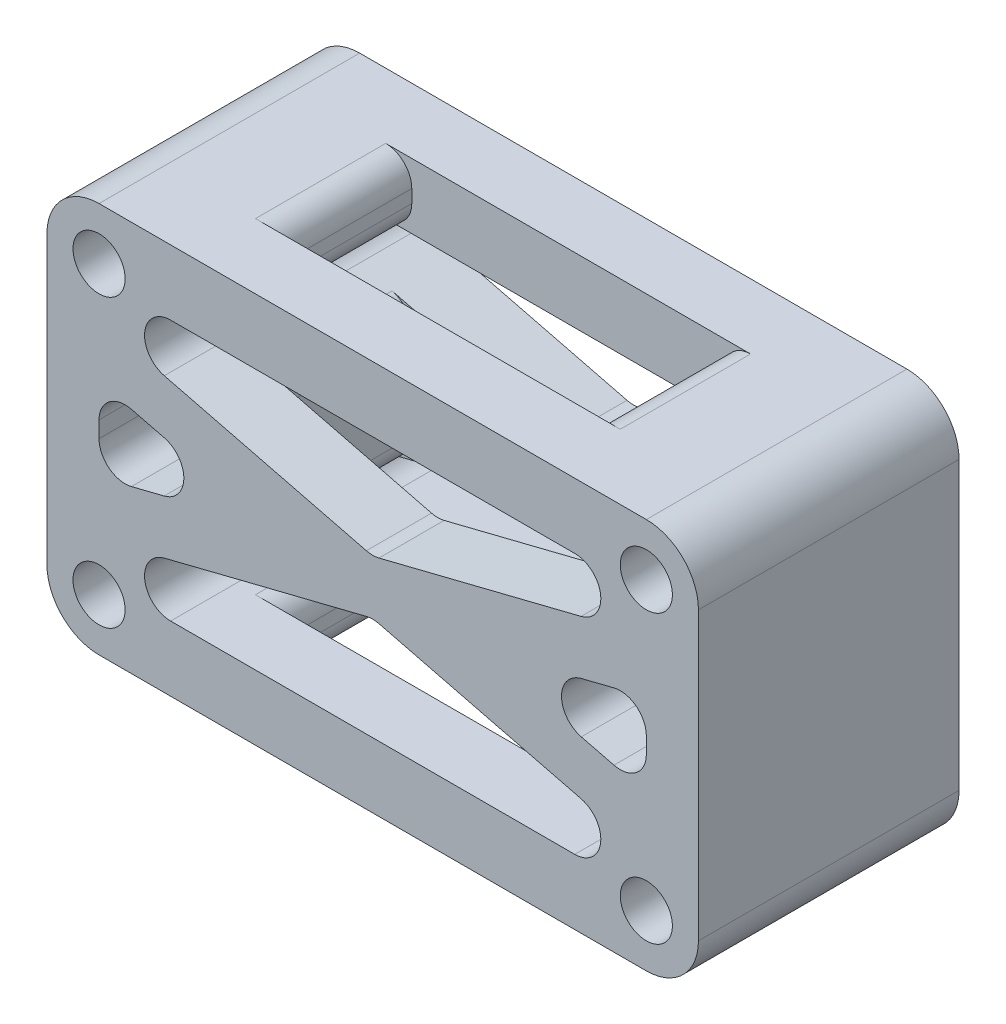
from build123d import *

# Parameters (mm, degrees)
SKETCH_1_W               = 25
SKETCH_1_H               = 15
EXTRUDE_1_DEPTH          = 10
FILLET_4_R               = 2
CUT_EXTRUDE_3_DEPTH      = 10
SKETCH_3_R               = 1
CUT_EXTRUDE_4_DEPTH      = 10
CUT_EXTRUDE_5_DEPTH      = 22.937410968
CUT_EXTRUDE_5_DEPTH_BACK = 22.937410968
SKETCH_4_W               = 12
SKETCH_4_H               = 5
FILLET_5_R               = 1


with BuildPart() as part:
    # 草图1 → 凸台-拉伸1 (new body)
    with BuildSketch(Plane.XY):
        Rectangle(SKETCH_1_W, SKETCH_1_H)
    extrude(amount=EXTRUDE_1_DEPTH)

    # 圆角4
    fillet_4_edges = [part.edges().sort_by_distance(p)[0] for p in [
        (12.5, -7.5, 5),
        (-12.5, -7.5, 5),
        (-12.5, 7.5, 5),
        (12.5, 7.5, 5),
    ]]
    fillet(fillet_4_edges, radius=FILLET_4_R)

    # 草图2 → 切除-拉伸3 (cut)
    with BuildSketch(Plane.XY.offset(10)):
        with BuildLine():
            Line((-0.242535625, -1.091410313), (-7.996324374, -3.0298575))
            ThreePointArc((-7.996324374, -3.0298575), (-8.746296305, -4.122183264), (-7.753788749, -5))
            Line((-7.753788749, -5), (7.753788749, -5))
            ThreePointArc((7.753788749, -5), (8.746296305, -4.122183264), (7.996324374, -3.0298575))
            Line((7.996324374, -3.0298575), (0.242535625, -1.091410313))
            ThreePointArc((0.242535625, -1.091410313), (0, -1.061552813), (-0.242535625, -1.091410313))
        make_face()
        with BuildLine():
            Line((7.753788749, 5), (-7.753788749, 5))
            ThreePointArc((-7.753788749, 5), (-8.746296305, 4.122183264), (-7.996324374, 3.0298575))
            Line((-7.996324374, 3.0298575), (-0.242535625, 1.091410313))
            ThreePointArc((-0.242535625, 1.091410313), (0, 1.061552813), (0.242535625, 1.091410313))
            Line((0.242535625, 1.091410313), (7.996324374, 3.0298575))
            ThreePointArc((7.996324374, 3.0298575), (8.746296305, 4.122183264), (7.753788749, 5))
        make_face()
        with BuildLine():
            Line((-9.257464375, -1.283589687), (-8.003675626, -0.9701425))
            ThreePointArc((-8.003675626, -0.9701425), (-7.246211251, 0), (-8.003675626, 0.9701425))
            Line((-8.003675626, 0.9701425), (-9.257464375, 1.283589687))
            ThreePointArc((-9.257464375, 1.283589687), (-10.115412209, 1.101652625), (-10.5, 0.313447187))
            Line((-10.5, 0.313447187), (-10.5, -0.313447187))
            ThreePointArc((-10.5, -0.313447187), (-10.115412209, -1.101652625), (-9.257464375, -1.283589687))
        make_face()
        with BuildLine():
            Line((10.5, 0.313447187), (10.5, -0.313447187))
            ThreePointArc((10.5, -0.313447187), (10.115412209, -1.101652625), (9.257464375, -1.283589687))
            Line((9.257464375, -1.283589687), (8.003675626, -0.9701425))
            ThreePointArc((8.003675626, -0.9701425), (7.246211251, 0), (8.003675626, 0.9701425))
            Line((8.003675626, 0.9701425), (9.257464375, 1.283589687))
            ThreePointArc((9.257464375, 1.283589687), (10.115412209, 1.101652625), (10.5, 0.313447187))
        make_face()
    extrude(amount=-CUT_EXTRUDE_3_DEPTH, mode=Mode.SUBTRACT)

    # 草图3 → 切除-拉伸4 (cut)
    with BuildSketch(Plane.XY.offset(10)):
        with Locations((-10.5, 5.5)):
            Circle(SKETCH_3_R)
        with Locations(Location((10.5, 5.5, 0), (0, 0, 180))):
            Circle(SKETCH_3_R)
        with Locations((10.5, -5.5)):
            Circle(SKETCH_3_R)
        with Locations(Location((-10.5, -5.5, 0), (0, 0, 180))):
            Circle(SKETCH_3_R)
    extrude(amount=-CUT_EXTRUDE_4_DEPTH, mode=Mode.SUBTRACT)

    # 草图4 → 切除-拉伸5 (cut, two sides: drawn at the far end of the back side and taken through both)
    with BuildSketch(Plane(origin=(0, 7.5, 0), x_dir=(1, 0, 0), z_dir=(0, 1, 0)).offset(-CUT_EXTRUDE_5_DEPTH_BACK)):
        with Locations((0, -5)):
            Rectangle(SKETCH_4_W, SKETCH_4_H)
    extrude(amount=CUT_EXTRUDE_5_DEPTH + CUT_EXTRUDE_5_DEPTH_BACK, mode=Mode.SUBTRACT)

    # 圆角5
    fillet_5_edges = [part.edges().sort_by_distance(p)[0] for p in [
        (6, 2.530776406, 5),
        (-6, 5, 5),
        (-6, 7.5, 5),
        (-6, -5, 5),
        (-6, -7.5, 5),
        (-6, -2.530776406, 5),
        (-6, 2.530776406, 5),
        (6, 7.5, 5),
        (6, 5, 5),
        (6, -2.530776406, 5),
        (6, -5, 5),
        (6, -7.5, 5),
    ]]
    fillet(fillet_5_edges, radius=FILLET_5_R)


solid = part.part
